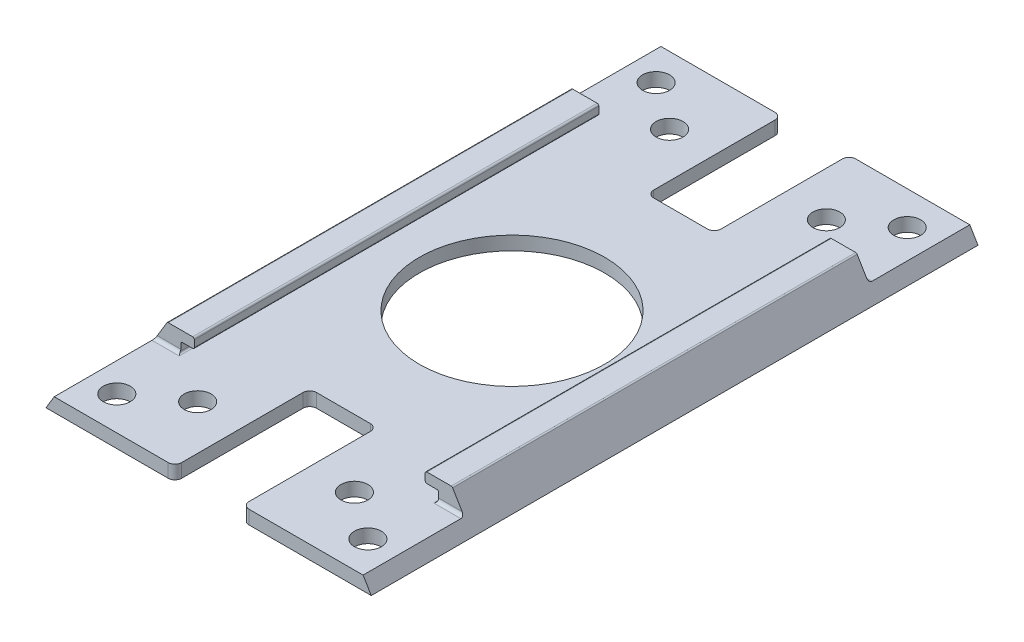
from build123d import *

# Parameters (mm, degrees)
BOSS_EXTRUDE1_DEPTH     = 180
SKETCH2_W               = 91.64
SKETCH2_H               = 8.017032047
CUT_EXTRUDE1_DEPTH      = 30
SKETCH3_W               = 91.64
SKETCH3_H               = 8.483725915
CUT_EXTRUDE2_DEPTH      = 30
FILLET1_R               = 1
FILLET2_R               = 1
FILLET3_R               = 1
CUT_EXTRUDE3_DEPTH      = 200.729129072
CUT_EXTRUDE3_DEPTH_BACK = 200.729129072
SKETCH4_R               = 4
SKETCH4_R_2             = 27.5


with BuildPart() as part:
    # Sketch1 → Boss-Extrude1 (new body)
    with BuildSketch(Plane.XY):
        with BuildLine():
            Line((-80.35, -4.05), (-79.85, -4.05))
            Line((-79.85, -4.05), (3.65, -4.05))
            Line((3.65, -4.05), (4.15, -4.05))
            Line((4.15, -4.05), (10.15, -4.05))
            Line((10.15, -4.05), (4.295651273, 5.707247878))
            ThreePointArc((4.295651273, 5.707247878), (4.113254218, 5.885099953), (3.866904811, 5.95))
            Line((3.866904811, 5.95), (3.65, 5.95))
            Line((3.65, 5.95), (-3.35, 5.95))
            ThreePointArc((-3.35, 5.95), (-3.703553391, 5.803553391), (-3.85, 5.45))
            Line((-3.85, 5.45), (-3.85, 3.45))
            ThreePointArc((-3.85, 3.45), (-3.703553391, 3.096446609), (-3.35, 2.95))
            Line((-3.35, 2.95), (-0.35, 2.95))
            ThreePointArc((-0.35, 2.95), (0.003553391, 2.803553391), (0.15, 2.45))
            Line((0.15, 2.45), (0.15, 0.5))
            ThreePointArc((0.15, 0.5), (0.003553391, 0.146446609), (-0.35, 0))
            Line((-0.35, 0), (-75.85, 0))
            ThreePointArc((-75.85, 0), (-76.203553391, 0.146446609), (-76.35, 0.5))
            Line((-76.35, 0.5), (-76.35, 2.45))
            ThreePointArc((-76.35, 2.45), (-76.203553391, 2.803553391), (-75.85, 2.95))
            Line((-75.85, 2.95), (-72.85, 2.95))
            ThreePointArc((-72.85, 2.95), (-72.496446609, 3.096446609), (-72.35, 3.45))
            Line((-72.35, 3.45), (-72.35, 5.45))
            ThreePointArc((-72.35, 5.45), (-72.496446609, 5.803553391), (-72.85, 5.95))
            Line((-72.85, 5.95), (-79.85, 5.95))
            Line((-79.85, 5.95), (-80.066904811, 5.95))
            ThreePointArc((-80.066904811, 5.95), (-80.313254218, 5.885099953), (-80.495651273, 5.707247878))
            Line((-80.495651273, 5.707247878), (-86.35, -4.05))
            Line((-86.35, -4.05), (-80.35, -4.05))
        make_face()
    extrude(amount=BOSS_EXTRUDE1_DEPTH)

    # Sketch2 → Cut-Extrude1 (cut)
    with BuildSketch(Plane.XY.offset(180)):
        with Locations((-38.1, 4.008516024)):
            Rectangle(SKETCH2_W, SKETCH2_H)
    extrude(amount=-CUT_EXTRUDE1_DEPTH, mode=Mode.SUBTRACT)

    # Sketch3 → Cut-Extrude2 (cut)
    with BuildSketch(Plane(origin=(0, 0, 0), x_dir=(-1, 0, 0), z_dir=(0, 0, -1))):
        with Locations((38.1, 4.241862958)):
            Rectangle(SKETCH3_W, SKETCH3_H)
    extrude(amount=-CUT_EXTRUDE2_DEPTH, mode=Mode.SUBTRACT)

    # Fillet1
    fillet1_edges = [part.edges().sort_by_distance(p)[0] for p in [
        (-79.885, 0, 150),
    ]]
    fillet(fillet1_edges, radius=FILLET1_R)

    # Fillet2
    fillet2_edges = [part.edges().sort_by_distance(p)[0] for p in [
        (3.685, 0, 150),
    ]]
    fillet(fillet2_edges, radius=FILLET2_R)

    # Fillet3
    fillet3_edges = [part.edges().sort_by_distance(p)[0] for p in [
        (-79.885, 0, 30),
        (3.685, 0, 30),
    ]]
    fillet(fillet3_edges, radius=FILLET3_R)

    # Sketch4 → Cut-Extrude3 (cut, two sides: drawn at the far end of the back side and taken through both)
    with BuildSketch(Plane(origin=(0, 0, 0), x_dir=(1, 0, 0), z_dir=(0, 1, 0)).offset(-CUT_EXTRUDE3_DEPTH_BACK)):
        with BuildLine():
            Line((-28.1, -38), (-28.1, -2))
            ThreePointArc((-28.1, -2), (-27.514213562, -0.585786438), (-26.1, 0))
            Line((-26.1, 0), (-50.1, 0))
            ThreePointArc((-50.1, 0), (-48.685786438, -0.585786438), (-48.1, -2))
            Line((-48.1, -2), (-48.1, -38))
            ThreePointArc((-48.1, -38), (-47.514213562, -39.414213562), (-46.1, -40))
            Line((-46.1, -40), (-30.1, -40))
            ThreePointArc((-30.1, -40), (-28.685786438, -39.414213562), (-28.1, -38))
        make_face()
        with Locations(Location((-75.35, -10, 0), (0, 0, 270))):
            Circle(SKETCH4_R)
        with Locations(Location((-61.35, -20, 0), (0, 0, 270))):
            Circle(SKETCH4_R)
        with Locations(Location((-14.85, -20, 0), (0, 0, 270))):
            Circle(SKETCH4_R)
        with Locations(Location((-0.85, -10, 0), (0, 0, 270))):
            Circle(SKETCH4_R)
        with Locations(Location((-38.1, -90, 0), (0, 0, 270))):
            Circle(SKETCH4_R_2)
        with BuildLine():
            ThreePointArc((-30.1, -140), (-28.685786438, -140.585786438), (-28.1, -142))
            Line((-28.1, -142), (-28.1, -178))
            ThreePointArc((-28.1, -178), (-27.514213562, -179.414213562), (-26.1, -180))
            Line((-26.1, -180), (-50.1, -180))
            ThreePointArc((-50.1, -180), (-48.685786438, -179.414213562), (-48.1, -178))
            Line((-48.1, -178), (-48.1, -142))
            ThreePointArc((-48.1, -142), (-47.514213562, -140.585786438), (-46.1, -140))
            Line((-46.1, -140), (-30.1, -140))
        make_face()
        with Locations(Location((-61.35, -160, 0), (0, 0, 270))):
            Circle(SKETCH4_R)
        with Locations(Location((-75.35, -170, 0), (0, 0, 270))):
            Circle(SKETCH4_R)
        with Locations(Location((-14.85, -160, 0), (0, 0, 270))):
            Circle(SKETCH4_R)
        with Locations(Location((-0.85, -170, 0), (0, 0, 270))):
            Circle(SKETCH4_R)
    extrude(amount=CUT_EXTRUDE3_DEPTH + CUT_EXTRUDE3_DEPTH_BACK, mode=Mode.SUBTRACT)


solid = part.part
